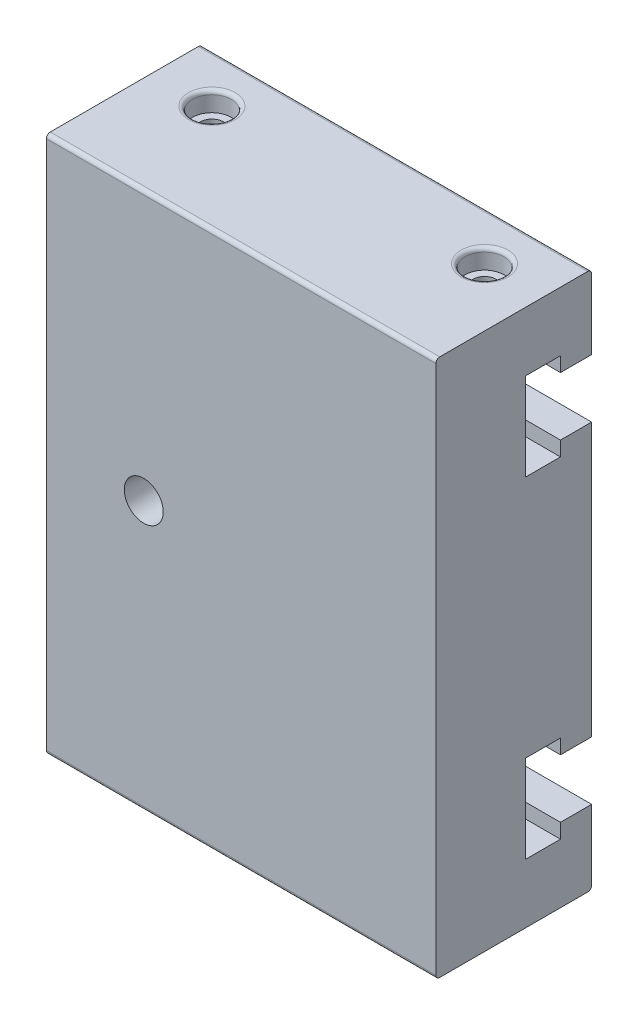
from build123d import *

# Parameters (mm, degrees)
SKETCH1_W           = 20
SKETCH1_H           = 27.6
BOSS_EXTRUDE1_DEPTH = 4
SKETCH3_R           = 1
CUT_EXTRUDE2_DEPTH  = 4
SKETCH4_W           = 1.6
SKETCH4_H           = 3
SKETCH4_W_2         = 1.8
SKETCH4_H_2         = 4.5
CUT_EXTRUDE3_DEPTH  = 25.626002518
CUT_EXTRUDE4_REACH  = 20.827
SKETCH5_R           = 1.5
SKETCH6_R           = 1
CUT_EXTRUDE5_DEPTH  = 1
SKETCH7_R           = 0.6
CUT_EXTRUDE6_DEPTH  = 30.627014699
FILLET1_R           = 1
FILLET2_R           = 0.2


with BuildPart() as part:
    # Sketch1 → Boss-Extrude1 (new, symmetric)
    with BuildSketch(Plane.XY):
        Rectangle(SKETCH1_W, SKETCH1_H)
    extrude(amount=BOSS_EXTRUDE1_DEPTH, both=True)

    # Sketch3 → Cut-Extrude2 (cut)
    with BuildSketch(Plane.XY.offset(4)):
        with Locations((-5, 0)):
            Circle(SKETCH3_R)
    extrude(amount=-CUT_EXTRUDE2_DEPTH, mode=Mode.SUBTRACT)

    # Sketch4 → Cut-Extrude3 (cut, through all)
    with BuildSketch(Plane(origin=(10, 0, 0), x_dir=(0, 0, -1), z_dir=(1, 0, 0))):
        with Locations((3.2, 8.5)):
            Rectangle(SKETCH4_W, SKETCH4_H)
        with Locations((1.5, 8.5)):
            Rectangle(SKETCH4_W_2, SKETCH4_H_2)
    cut_extrude3 = extrude(amount=-CUT_EXTRUDE3_DEPTH, mode=Mode.SUBTRACT)

    # Cut-Extrude4: up to this face of the body (flat: up to its plane)
    cut_extrude4_end = Plane(part.part.faces().sort_by_distance((0, 8.5, -0.6))[0])
    # Sketch5 → Cut-Extrude4 (cut, up to the picked face)
    with BuildSketch(Plane(origin=(0, 0, -4), x_dir=(-1, 0, 0), z_dir=(0, 0, -1)), mode=Mode.PRIVATE) as cut_extrude4_sk1:
        with Locations((0, 7)):
            Circle(SKETCH5_R)
    cut_extrude4_tool1 = split(extrude(cut_extrude4_sk1.sketch, amount=-CUT_EXTRUDE4_REACH, mode=Mode.PRIVATE), bisect_by=cut_extrude4_end, keep=Keep.BOTH, mode=Mode.PRIVATE)
    cut_extrude4 = cut_extrude4_tool1.solids().sort_by(Axis((0, 7, -4), (0, 0, 1)))[0]
    add(cut_extrude4, mode=Mode.SUBTRACT)

    # Mirror1: Cut-Extrude3, Cut-Extrude4 across plane
    add(cut_extrude3.mirror(Plane.ZX), mode=Mode.SUBTRACT)
    add(cut_extrude4.mirror(Plane.ZX), mode=Mode.SUBTRACT)

    # Sketch6 → Cut-Extrude5 (cut)
    with BuildSketch(Plane.XZ.offset(13.8)):
        with Locations((-7, -1.5)):
            Circle(SKETCH6_R)
        with Locations(Location((7, -1.5, 0), (0, 0, 180))):
            Circle(SKETCH6_R)
    cut_extrude5 = extrude(amount=-CUT_EXTRUDE5_DEPTH, mode=Mode.SUBTRACT)

    # Sketch7 → Cut-Extrude6 (cut, through all)
    with BuildSketch(Plane.XZ.offset(13.8)):
        with Locations((-7, -1.5)):
            Circle(SKETCH7_R)
        with Locations((7, -1.5)):
            Circle(SKETCH7_R)
    extrude(amount=-CUT_EXTRUDE6_DEPTH, mode=Mode.SUBTRACT)

    # Fillet1
    fillet1_edges = [part.edges().sort_by_distance(p)[0] for p in [
        (-1.5, 7, -3.2),
        (1.5, 7, -3.2),
        (1.5, -7, -3.2),
        (-1.5, -7, -3.2),
    ]]
    fillet(fillet1_edges, radius=FILLET1_R)

    # Mirror2: Cut-Extrude5 across plane
    add(cut_extrude5.mirror(Plane.ZX), mode=Mode.SUBTRACT)

    # Fillet2
    fillet2_edges = [part.edges().sort_by_distance(p)[0] for p in [
        (-8, -13.8, -1.5),
        (8, -13.8, -1.5),
        (0, 13.8, 4),
        (-8, 13.8, -1.5),
        (8, 13.8, -1.5),
        (0, 13.8, -4),
        (0, -13.8, -4),
        (0, -13.8, 4),
    ]]
    fillet(fillet2_edges, radius=FILLET2_R)


solid = part.part
